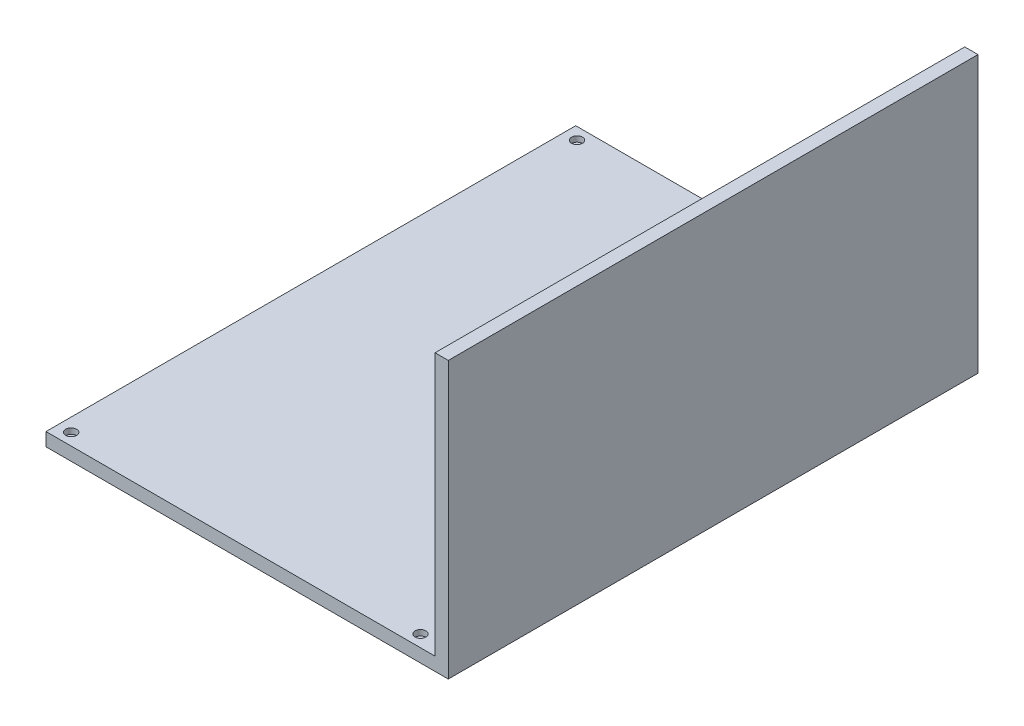
from build123d import *

# Parameters (mm, degrees)
SALIENTE_EXTRUIR1_DEPTH = 200
CROQUIS3_R              = 2.05
CORTAR_EXTRUIR1_DEPTH   = 2.1
CROQUIS4_R              = 2.05
CORTAR_EXTRUIR2_DEPTH   = 2.1


with BuildPart() as part:
    # Croquis2 → Saliente-Extruir1 (new body)
    with BuildSketch(Plane.XY):
        Polygon((0, 0), (146.881, 0), (146.881, 99.2), (151.881, 99.2), (151.881, -5), (0, -5), align=None)
    extrude(amount=SALIENTE_EXTRUIR1_DEPTH)

    # Croquis3 → Cortar-Extruir1 (cut)
    with BuildSketch(Plane(origin=(0, 0, 0), x_dir=(1, 0, 0), z_dir=(0, 1, 0))):
        with Locations(Location((5, -195.5, 0), (0, 0, 270))):
            Circle(CROQUIS3_R)
        with Locations(Location((136.881, -195.5, 0), (0, 0, 270))):
            Circle(CROQUIS3_R)
        with Locations(Location((136.881, -4.5, 0), (0, 0, 90))):
            Circle(CROQUIS3_R)
        with Locations(Location((5, -4.5, 0), (0, 0, 90))):
            Circle(CROQUIS3_R)
    extrude(amount=-CORTAR_EXTRUIR1_DEPTH, mode=Mode.SUBTRACT)

    # Croquis4 → Cortar-Extruir2 (cut)
    with BuildSketch(Plane.ZY.offset(-146.881)):
        with Locations((4.5, 15)):
            Circle(CROQUIS4_R)
        with Locations((4.5, 94.7)):
            Circle(CROQUIS4_R)
        with Locations(Location((195.5, 15, 0), (0, 0, 180))):
            Circle(CROQUIS4_R)
        with Locations(Location((195.5, 94.7, 0), (0, 0, 180))):
            Circle(CROQUIS4_R)
    extrude(amount=-CORTAR_EXTRUIR2_DEPTH, mode=Mode.SUBTRACT)


solid = part.part
